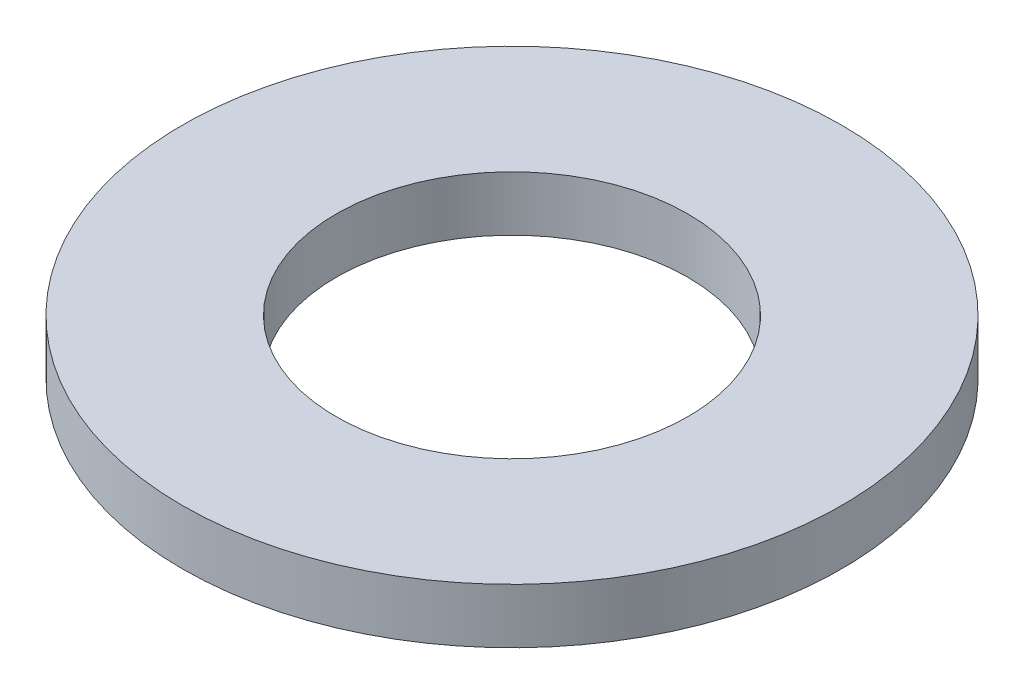
from build123d import *

# Parameters (mm, degrees)
SKETCH1_R           = 6
SKETCH1_R_2         = 3.2
BOSS_EXTRUDE1_DEPTH = 1


with BuildPart() as part:
    # Sketch1 → Boss-Extrude1 (new body)
    with BuildSketch(Plane(origin=(0, 0, 0), x_dir=(1, 0, 0), z_dir=(0, 1, 0))):
        with Locations(Location((0, 0, 0), (0, 0, 270))):
            Circle(SKETCH1_R)
        with Locations(Location((0, 0, 0), (0, 0, 270))):
            Circle(SKETCH1_R_2, mode=Mode.SUBTRACT)
    extrude(amount=BOSS_EXTRUDE1_DEPTH)


solid = part.part
